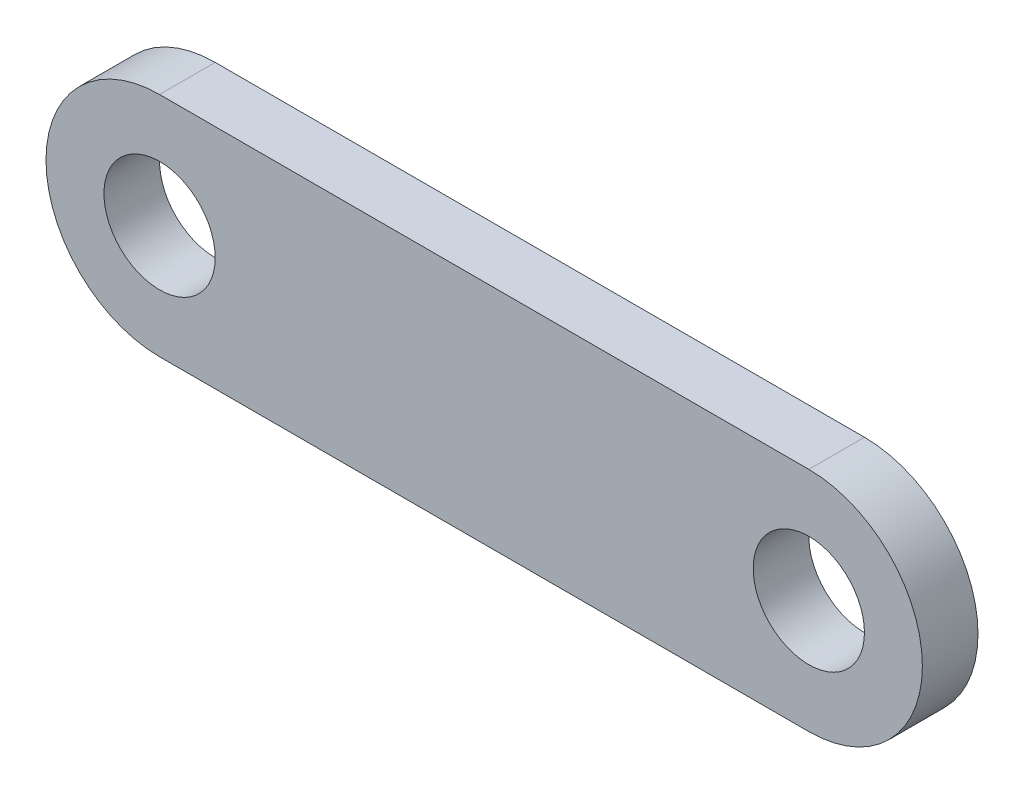
from build123d import *

# Parameters (mm, degrees)
ESBO_O1_R                = 1
RESSALTO_EXTRUS_O1_DEPTH = 1


with BuildPart() as part:
    # Esboço1 → Ressalto-extrusão1 (new body)
    with BuildSketch(Plane.XY):
        with BuildLine():
            Line((-5.835, 2.041311144), (5.835, 2.041311144))
            ThreePointArc((5.835, 2.041311144), (7.876311144, 0), (5.835, -2.041311144))
            Line((5.835, -2.041311144), (-5.835, -2.041311144))
            ThreePointArc((-5.835, -2.041311144), (-7.876311144, 0), (-5.835, 2.041311144))
        make_face()
        with Locations((-5.835, 0)):
            Circle(ESBO_O1_R, mode=Mode.SUBTRACT)
        with Locations((5.835, 0)):
            Circle(ESBO_O1_R, mode=Mode.SUBTRACT)
    extrude(amount=RESSALTO_EXTRUS_O1_DEPTH)


solid = part.part
